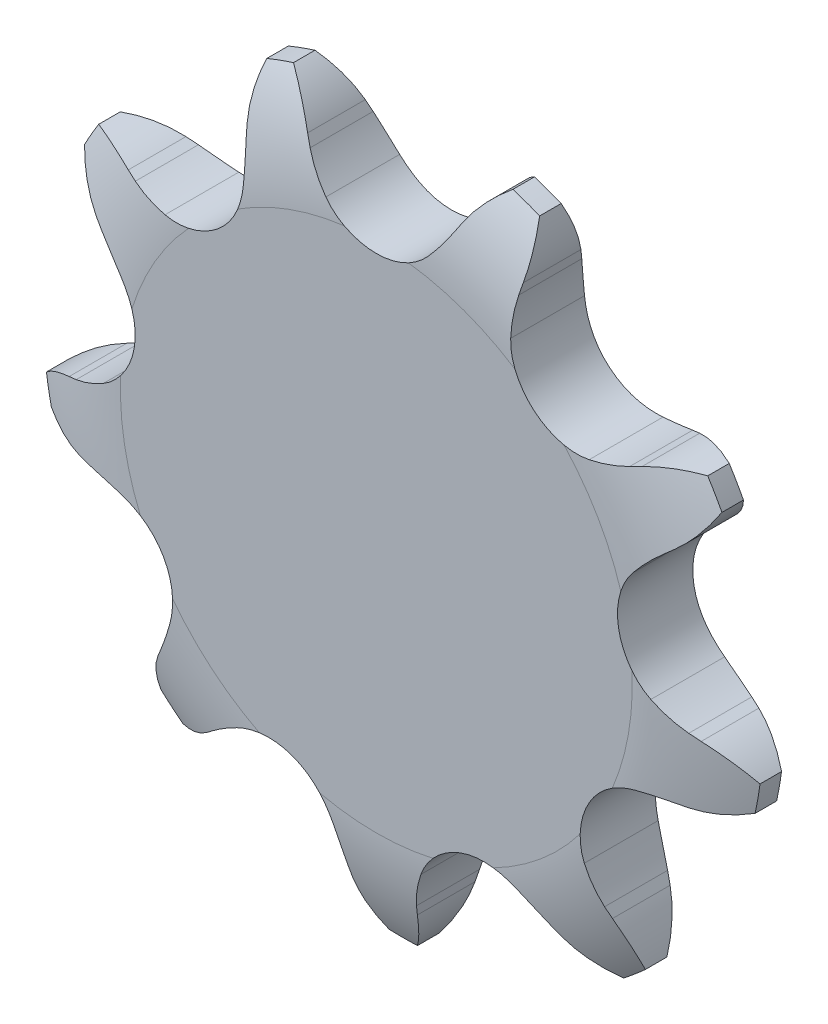
from build123d import *

# Parameters (mm, degrees)
CUT_EXTRUDE1_DEPTH  = 19.987874087
CIRPATTERN1_COUNT   = 9
BOSS_EXTRUDE1_START = 1.4
SKETCH2_R           = 7.5
BOSS_EXTRUDE1_DEPTH = 9.2
SKETCH4_W           = 2.1
SKETCH4_H           = 6.994692077
SKETCH6_R           = 11
CUT_EXTRUDE4_DEPTH  = 10


with BuildPart() as part:
    # Sketch1 → Revolve1 (revolve)
    with BuildSketch(Plane(origin=(0, 0, 0), x_dir=(0, 0, -1), z_dir=(1, 0, 0))):
        with BuildLine():
            Line((1.4, 0), (-1.4, 0))
            Line((-1.4, 0), (-1.4, 9.516926332))
            ThreePointArc((-1.4, 9.516926332), (-1.145966692, 11.516926332), (-0.4, 13.389909678))
            Line((-0.4, 13.389909678), (0.4, 13.389909678))
            ThreePointArc((0.4, 13.389909678), (1.145966692, 11.516926332), (1.4, 9.516926332))
            Line((1.4, 9.516926332), (1.4, 0))
        make_face()
    revolve(axis=Axis((0, 0, -1.4), (0, 0, 1)))

    # Sketch0 → Cut-Extrude1 (cut, symmetric)
    with BuildSketch(Plane.XY):
        with BuildLine():
            Line((6.616949071, -9.749335721), (6.321966392, -9.500839456))
            ThreePointArc((6.321966392, -9.500839456), (5.785682947, -9.094269701), (5.210515703, -8.744868009))
            ThreePointArc((5.210515703, -8.744868009), (3.127643422, -8.593129679), (1.629606205, -10.048212478))
            ThreePointArc((1.629606205, -10.048212478), (1.413593612, -10.68558008), (1.26411466, -11.341746936))
            Line((1.26411466, -11.341746936), (1.197875138, -11.72171733))
            ThreePointArc((1.197875138, -11.72171733), (-0.715404271, -14.586897371), (-4.122150016, -15.100685451))
            ThreePointArc((-4.122150016, -15.100685451), (5.353711364, -14.709201082), (12.864283619, -8.918129222))
            ThreePointArc((12.864283619, -8.918129222), (9.92430836, -10.714358673), (6.616949071, -9.749335721))
        make_face()
    cut_extrude1 = extrude(amount=CUT_EXTRUDE1_DEPTH, both=True, mode=Mode.SUBTRACT)

    # CirPattern1: Cut-Extrude1 ×9 about axis
    cirpattern1_axis = Axis((0, 0, 0), (0, 0, 1))
    for i in range(1, CIRPATTERN1_COUNT):
        add(cut_extrude1.rotate(cirpattern1_axis, i * 360 / CIRPATTERN1_COUNT), mode=Mode.SUBTRACT)

    # Sketch2 → Boss-Extrude1 (add)
    with BuildSketch(Plane.XY.offset(BOSS_EXTRUDE1_START)):
        with Locations(Location((0, 0, 0), (0, 0, 270))):
            Circle(SKETCH2_R)
    extrude(amount=BOSS_EXTRUDE1_DEPTH)

    # Sketch4 → Cut-Revolve1 (revolve, cut)
    with BuildSketch(Plane(origin=(0, 0, 0), x_dir=(0, 0, -1), z_dir=(1, 0, 0))):
        Polygon((-10.6, 7.5), (-10.6, 7), (-10.1, 7.5), align=None)
        with Locations((-2.45, 9.89256364)):
            Rectangle(SKETCH4_W, SKETCH4_H)
    revolve(axis=Axis((0, 0, -1.4), (0, 0, 1)), mode=Mode.SUBTRACT)

    # Sketch6 → Cut-Extrude4 (cut)
    with BuildSketch(Plane.XY.offset(1.4)):
        Circle(SKETCH6_R)
    extrude(amount=CUT_EXTRUDE4_DEPTH, mode=Mode.SUBTRACT)


solid = part.part
